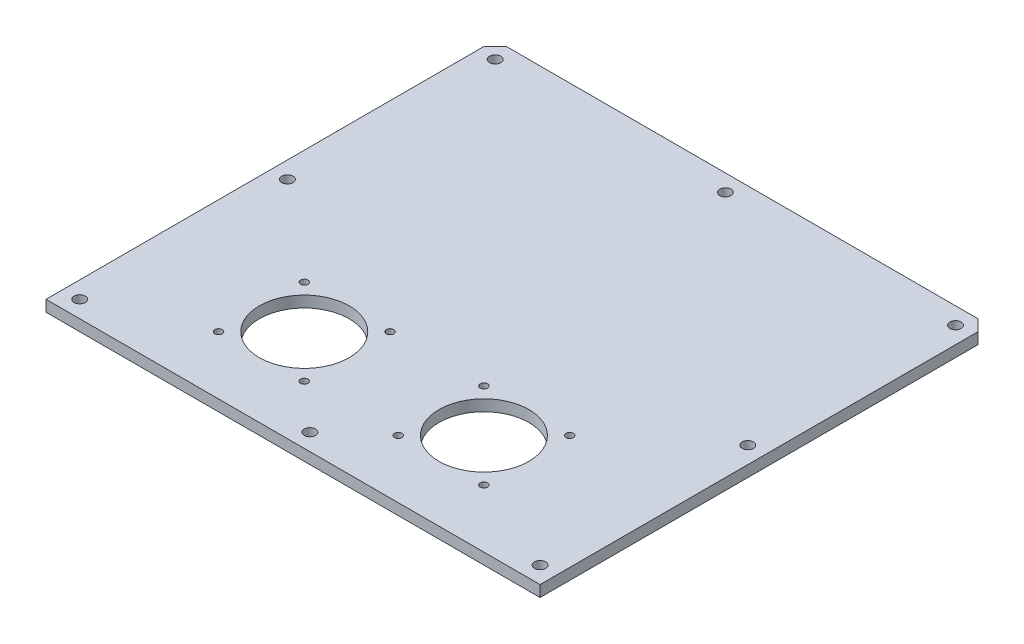
from build123d import *

# Parameters (mm, degrees)
BOSS_EXTRUDE1_DEPTH   = 5
CHAMFER1_SIZE         = 5
BOSS_EXTRUDE5_DEPTH   = 5
CHAMFER2_SIZE         = 2
SKETCH9_R             = 20
CUT_EXTRUDE4_DEPTH    = 5
M6_TAPPED_HOLE1_D     = 5
M4_TAPPED_HOLE1_D     = 3.3
M4_TAPPED_HOLE1_DEPTH = 5
M4_TAPPED_HOLE1_TIP   = 0.991420021


with BuildPart() as part:
    # Sketch1 → Boss-Extrude1 (new body)
    with BuildSketch(Plane(origin=(0, 0, 0), x_dir=(1, 0, 0), z_dir=(0, 1, 0))):
        Polygon((-110, -150), (110, -150), (110, 50), (-102.5, 50), (-110, 50), align=None)
    extrude(amount=BOSS_EXTRUDE1_DEPTH)

    # Chamfer1
    chamfer1_edges = [part.edges().sort_by_distance(p)[0] for p in [
        (110, 2.5, -50),
        (-110, 2.5, -50),
    ]]
    chamfer(chamfer1_edges, length=CHAMFER1_SIZE)

    # Sketch4 → Boss-Extrude5 (add)
    with BuildSketch(Plane.XZ):
        Polygon((95, 135), (0, 135), (-95, 135), (-95, -35), (95, -35), align=None)
        Polygon((-90, 130), (0, 130), (90, 130), (90, -30), (-90, -30), align=None, mode=Mode.SUBTRACT)
    extrude(amount=BOSS_EXTRUDE5_DEPTH)

    # Chamfer2
    chamfer2_edges = [part.edges().sort_by_distance(p)[0] for p in [
        (0, -5, 135),
        (-95, -5, 50),
        (0, -5, -35),
        (95, -5, 50),
    ]]
    chamfer(chamfer2_edges, length=CHAMFER2_SIZE)

    # Sketch9 → Cut-Extrude4 (cut)
    with BuildSketch(Plane(origin=(0, 5, 0), x_dir=(1, 0, 0), z_dir=(0, 1, 0))):
        with Locations(Location((40, -105, 0), (0, 0, 270))):
            Circle(SKETCH9_R)
        with Locations(Location((-40, -105, 0), (0, 0, 270))):
            Circle(SKETCH9_R)
    extrude(amount=-CUT_EXTRUDE4_DEPTH, mode=Mode.SUBTRACT)

    # M6 Tapped Hole1 (through all)
    with Locations(Plane(origin=(0, 5, 0), x_dir=(1, 0, 0), z_dir=(0, 1, 0))):
        with Locations((-102.5, 42.5), (0, 42.5), (102.5, 42.5), (102.5, -50), (-102.5, -50), (-102.5, -142.5), (0, -142.5), (102.5, -142.5)):
            Hole(M6_TAPPED_HOLE1_D / 2)

    # M4 Tapped Hole1
    with Locations(Plane(origin=(0, 5, 0), x_dir=(1, 0, 0), z_dir=(0, 1, 0))):
        with Locations((-59.091883092, -85.908116908), (-20.908116908, -85.908116908), (-20.908116908, -124.091883092), (-59.091883092, -124.091883092), (20.908116908, -85.908116908), (59.091883092, -85.908116908), (59.091883092, -124.091883092), (20.908116908, -124.091883092)):
            Hole(M4_TAPPED_HOLE1_D / 2, depth=M4_TAPPED_HOLE1_DEPTH)
            with Locations((0, 0, -(M4_TAPPED_HOLE1_DEPTH + M4_TAPPED_HOLE1_TIP / 2))):  # 118° drill point
                Cone(0, M4_TAPPED_HOLE1_D / 2, M4_TAPPED_HOLE1_TIP, mode=Mode.SUBTRACT)


solid = part.part
